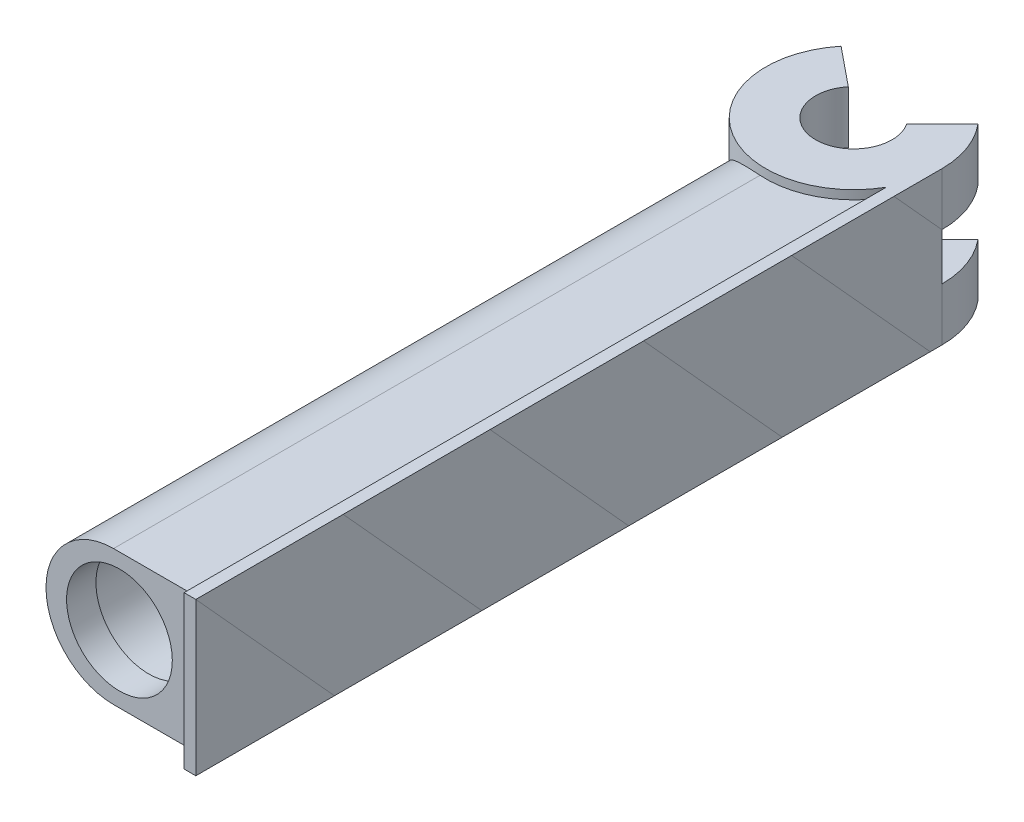
from build123d import *

# Parameters (mm, degrees)
SKETCH1_R           = 30
BOSS_EXTRUDE1_DEPTH = 26
BOSS_EXTRUDE2_DEPTH = 250
SKETCH3_R           = 13
CUT_EXTRUDE1_DEPTH  = 26
SKETCH1_2_R         = 30
CUT_EXTRUDE2_DEPTH  = 8
SKETCH4_R           = 19
CUT_EXTRUDE3_DEPTH  = 210
SKETCH6_R           = 19
SKETCH6_R_2         = 18
BOSS_EXTRUDE3_DEPTH = 10
SKETCH7_W           = 4
SKETCH7_H           = 4
BOSS_EXTRUDE4_DEPTH = 26
CUT_EXTRUDE4_REACH  = 262.998


with BuildPart() as part:
    # Sketch1 → Boss-Extrude1 (new, symmetric)
    with BuildSketch(Plane(origin=(0, 0, 0), x_dir=(1, 0, 0), z_dir=(0, 1, 0))):
        with Locations(Location((0, 0, 0), (0, 0, 90))):
            Circle(SKETCH1_R)
    extrude(amount=BOSS_EXTRUDE1_DEPTH, both=True)

    # Sketch2 → Boss-Extrude2 (add)
    with BuildSketch(Plane.XY):
        with BuildLine():
            Line((30, 26), (30, -26))
            Line((30, -26), (26, -26))
            Line((26, -26), (26, -23))
            Line((26, -23), (-2, -23))
            ThreePointArc((-2, -23), (-25, 0), (-2, 23))
            Line((-2, 23), (26, 23))
            Line((26, 23), (26, 26))
            Line((26, 26), (30, 26))
        make_face()
    extrude(amount=BOSS_EXTRUDE2_DEPTH)

    # Sketch3 → Cut-Extrude1 (cut, symmetric)
    with BuildSketch(Plane(origin=(0, 0, 0), x_dir=(1, 0, 0), z_dir=(0, 1, 0))):
        with Locations(Location((0, 0, 0), (0, 0, 270))):
            Circle(SKETCH3_R)
    extrude(amount=CUT_EXTRUDE1_DEPTH, both=True, mode=Mode.SUBTRACT)

    # Sketch1<2> → Cut-Extrude2 (cut, symmetric)
    with BuildSketch(Plane(origin=(0, 0, 0), x_dir=(1, 0, 0), z_dir=(0, 1, 0))):
        Circle(SKETCH1_2_R)
    extrude(amount=CUT_EXTRUDE2_DEPTH, both=True, mode=Mode.SUBTRACT)

    # Sketch4 → Cut-Extrude3 (cut)
    with BuildSketch(Plane.XY.offset(250)):
        Circle(SKETCH4_R)
    extrude(amount=-CUT_EXTRUDE3_DEPTH, mode=Mode.SUBTRACT)

    # Sketch6 → Boss-Extrude3 (add)
    with BuildSketch(Plane.XY.offset(250)):
        Circle(SKETCH6_R)
        Circle(SKETCH6_R_2, mode=Mode.SUBTRACT)
    extrude(amount=-BOSS_EXTRUDE3_DEPTH)

    # Sketch7 → Boss-Extrude4 (add, symmetric)
    with BuildSketch(Plane(origin=(0, 0, 0), x_dir=(1, 0, 0), z_dir=(0, 1, 0))):
        with Locations((28, -252)):
            Rectangle(SKETCH7_W, SKETCH7_H)
    extrude(amount=BOSS_EXTRUDE4_DEPTH, both=True)

    # Cut-Extrude4: up to this face of the body (flat: up to its plane)
    cut_extrude4_end = Plane(part.part.faces().sort_by_distance((28.902688409, -26, 134.483314774))[0])
    # Sketch9 → Cut-Extrude4 (cut, up to the picked face)
    with BuildSketch(Plane(origin=(0, 26, 0), x_dir=(1, 0, 0), z_dir=(0, 1, 0)), mode=Mode.PRIVATE) as cut_extrude4_sk1:
        with BuildLine():
            Line((-23.273636947, 18.92981308), (-10.085242677, 8.202919002))
            ThreePointArc((-10.085242677, 8.202919002), (0.632804436, 12.984589271), (10.835093825, 7.183365632))
            Line((10.835093825, 7.183365632), (22.960343515, 19.308615323))
            ThreePointArc((22.960343515, 19.308615323), (-0.245786449, 29.998993133), (-23.273636947, 18.92981308))
        make_face()
    cut_extrude4_tool1 = split(extrude(cut_extrude4_sk1.sketch, amount=-CUT_EXTRUDE4_REACH, mode=Mode.PRIVATE), bisect_by=cut_extrude4_end, keep=Keep.BOTH, mode=Mode.PRIVATE)
    add(cut_extrude4_tool1.solids().sort_by(Axis((0.119463, 26, -19.65599), (0, -1, 0)))[0], mode=Mode.SUBTRACT)


solid = part.part
